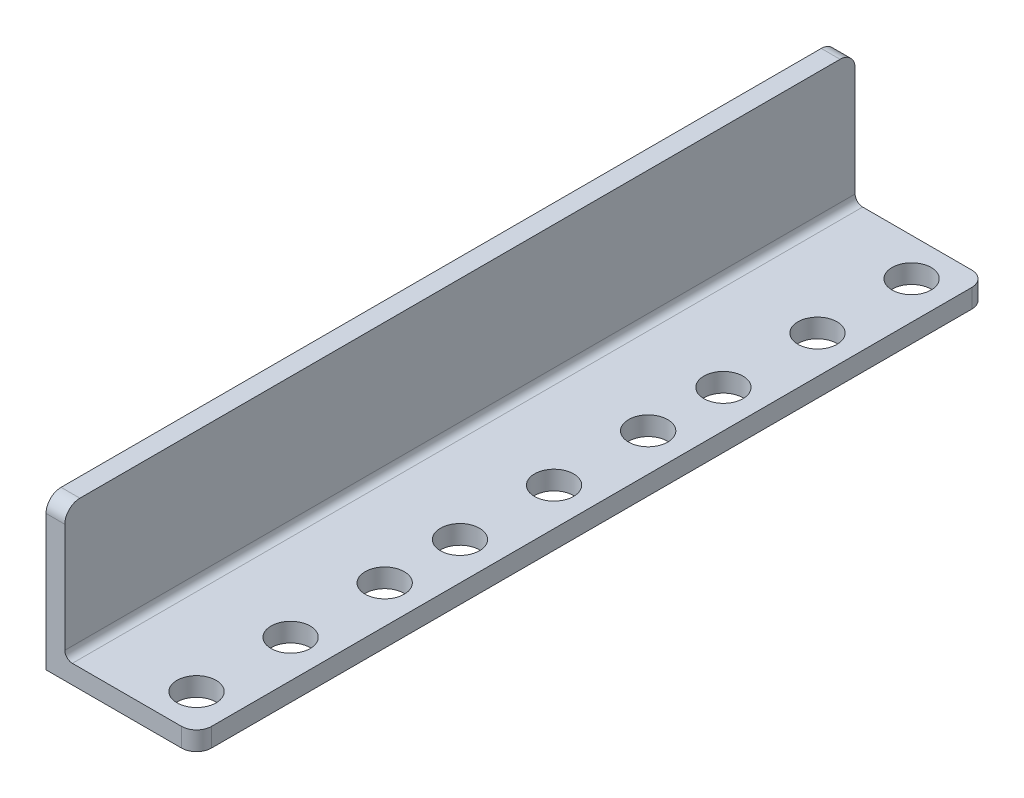
from build123d import *

# Parameters (mm, degrees)
BOSS_EXTRUDE1_DEPTH  = 66.675
M6_CLEARANCE_HOLE3_D = 6.6
LPATTERN1_COUNT      = 3
LPATTERN1_PITCH      = 44.45
FILLET1_R            = 2.54


with BuildPart() as part:
    # Sketch1 → Boss-Extrude1 (new, symmetric)
    with BuildSketch(Plane.XY):
        with BuildLine():
            Line((0, 0), (0, 25.4))
            Line((0, 25.4), (3.175, 25.4))
            Line((3.175, 25.4), (3.175, 4.445))
            ThreePointArc((3.175, 4.445), (3.546974388, 3.546974388), (4.445, 3.175))
            Line((4.445, 3.175), (25.4, 3.175))
            Line((25.4, 3.175), (25.4, 0))
            Line((25.4, 0), (0, 0))
        make_face()
    extrude(amount=BOSS_EXTRUDE1_DEPTH, both=True)

    # M6 Clearance Hole3 (through all)
    with Locations(Plane.XZ):
        with Locations((19.05, 60.325), (19.05, 44.45), (19.05, 28.575)):
            m6_clearance_hole3 = Hole(M6_CLEARANCE_HOLE3_D / 2)

    # LPattern1: M6 Clearance Hole3 ×3
    with Locations(*[(0, 0, -i * LPATTERN1_PITCH) for i in range(1, LPATTERN1_COUNT)]):
        add(m6_clearance_hole3, mode=Mode.SUBTRACT)

    # Fillet1
    fillet1_edges = [part.edges().sort_by_distance(p)[0] for p in [
        (1.5875, 25.4, 66.675),
        (1.5875, 25.4, -66.675),
        (25.4, 1.5875, 66.675),
        (25.4, 1.5875, -66.675),
    ]]
    fillet(fillet1_edges, radius=FILLET1_R)


solid = part.part
